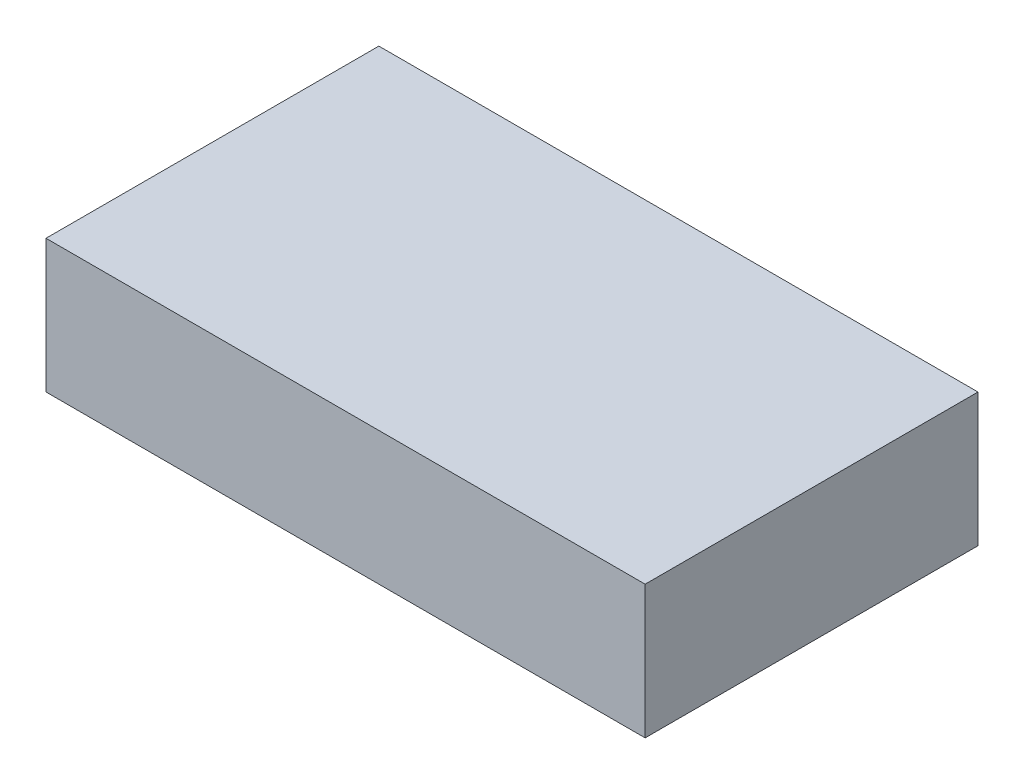
from build123d import *

# Parameters (mm, degrees)
SKETCH1_W           = 45
SKETCH1_H           = 25
BOSS_EXTRUDE1_DEPTH = 10


with BuildPart() as part:
    # Sketch1 → Boss-Extrude1 (new body)
    with BuildSketch(Plane(origin=(0, 0, 0), x_dir=(1, 0, 0), z_dir=(0, 1, 0))):
        Rectangle(SKETCH1_W, SKETCH1_H)
    extrude(amount=BOSS_EXTRUDE1_DEPTH)


solid = part.part
